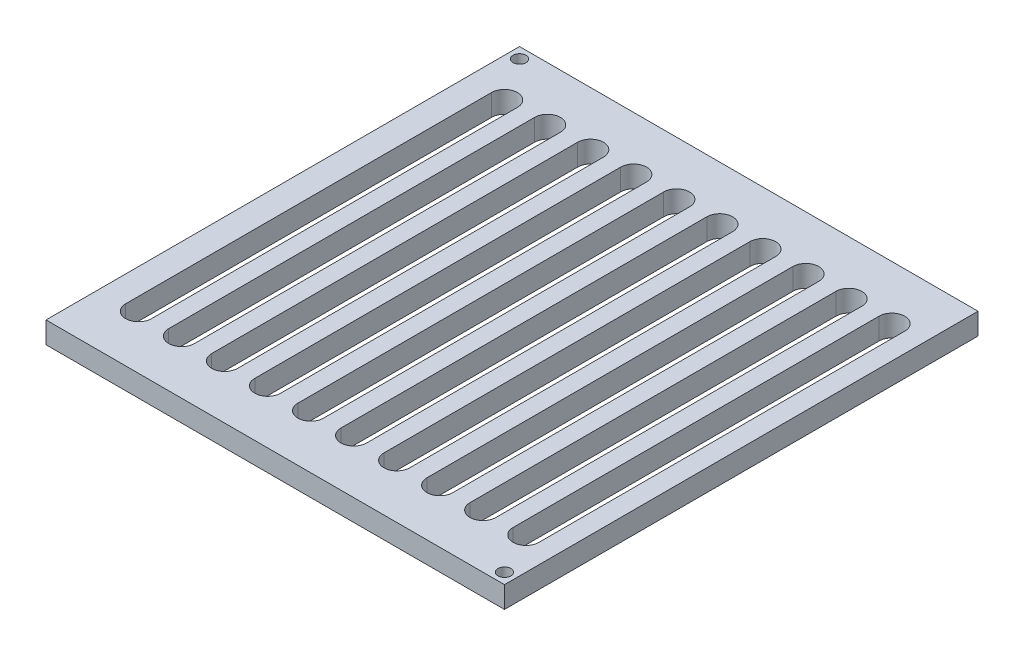
from build123d import *

# Parameters (mm, degrees)
SKETCH1_W           = 54.102
SKETCH1_H           = 55.88
BOSS_EXTRUDE1_DEPTH = 2.54
SKETCH2_R           = 0.762
CUT_EXTRUDE1_DEPTH  = 49.276


with BuildPart() as part:
    # Sketch1 → Boss-Extrude1 (new body)
    with BuildSketch(Plane(origin=(0, 0, 0), x_dir=(1, 0, 0), z_dir=(0, 1, 0))):
        with Locations((27.051, 27.94)):
            Rectangle(SKETCH1_W, SKETCH1_H)
    extrude(amount=BOSS_EXTRUDE1_DEPTH)

    # Sketch2 → Cut-Extrude1 (cut)
    with BuildSketch(Plane(origin=(0, 2.54, 0), x_dir=(1, 0, 0), z_dir=(0, 1, 0))):
        with Locations(Location((1.27, 54.61, 0), (0, 0, 270))):
            Circle(SKETCH2_R)
        with Locations(Location((52.832, 1.27, 0), (0, 0, 270))):
            Circle(SKETCH2_R)
        with BuildLine():
            Line((6.096, 49.53), (6.096, 6.35))
            ThreePointArc((6.096, 6.35), (4.572, 4.826), (3.048, 6.35))
            Line((3.048, 6.35), (3.048, 49.53))
            ThreePointArc((3.048, 49.53), (4.572, 51.054), (6.096, 49.53))
        make_face()
        with BuildLine():
            Line((11.176, 49.53), (11.176, 6.35))
            ThreePointArc((11.176, 6.35), (9.652, 4.826), (8.128, 6.35))
            Line((8.128, 6.35), (8.128, 49.53))
            ThreePointArc((8.128, 49.53), (9.652, 51.054), (11.176, 49.53))
        make_face()
        with BuildLine():
            Line((16.256, 49.53), (16.256, 6.35))
            ThreePointArc((16.256, 6.35), (14.732, 4.826), (13.208, 6.35))
            Line((13.208, 6.35), (13.208, 49.53))
            ThreePointArc((13.208, 49.53), (14.732, 51.054), (16.256, 49.53))
        make_face()
        with BuildLine():
            Line((21.336, 49.53), (21.336, 6.35))
            ThreePointArc((21.336, 6.35), (19.812, 4.826), (18.288, 6.35))
            Line((18.288, 6.35), (18.288, 49.53))
            ThreePointArc((18.288, 49.53), (19.812, 51.054), (21.336, 49.53))
        make_face()
        with BuildLine():
            Line((26.416, 49.53), (26.416, 6.35))
            ThreePointArc((26.416, 6.35), (24.892, 4.826), (23.368, 6.35))
            Line((23.368, 6.35), (23.368, 49.53))
            ThreePointArc((23.368, 49.53), (24.892, 51.054), (26.416, 49.53))
        make_face()
        with BuildLine():
            Line((31.496, 49.53), (31.496, 6.35))
            ThreePointArc((31.496, 6.35), (29.972, 4.826), (28.448, 6.35))
            Line((28.448, 6.35), (28.448, 49.53))
            ThreePointArc((28.448, 49.53), (29.972, 51.054), (31.496, 49.53))
        make_face()
        with BuildLine():
            Line((36.576, 49.53), (36.576, 6.35))
            ThreePointArc((36.576, 6.35), (35.052, 4.826), (33.528, 6.35))
            Line((33.528, 6.35), (33.528, 49.53))
            ThreePointArc((33.528, 49.53), (35.052, 51.054), (36.576, 49.53))
        make_face()
        with BuildLine():
            Line((41.656, 49.53), (41.656, 6.35))
            ThreePointArc((41.656, 6.35), (40.132, 4.826), (38.608, 6.35))
            Line((38.608, 6.35), (38.608, 49.53))
            ThreePointArc((38.608, 49.53), (40.132, 51.054), (41.656, 49.53))
        make_face()
        with BuildLine():
            Line((46.736, 49.53), (46.736, 6.35))
            ThreePointArc((46.736, 6.35), (45.212, 4.826), (43.688, 6.35))
            Line((43.688, 6.35), (43.688, 49.53))
            ThreePointArc((43.688, 49.53), (45.212, 51.054), (46.736, 49.53))
        make_face()
        with BuildLine():
            Line((51.816, 49.53), (51.816, 6.35))
            ThreePointArc((51.816, 6.35), (50.292, 4.826), (48.768, 6.35))
            Line((48.768, 6.35), (48.768, 49.53))
            ThreePointArc((48.768, 49.53), (50.292, 51.054), (51.816, 49.53))
        make_face()
    extrude(amount=-CUT_EXTRUDE1_DEPTH, mode=Mode.SUBTRACT)


solid = part.part
